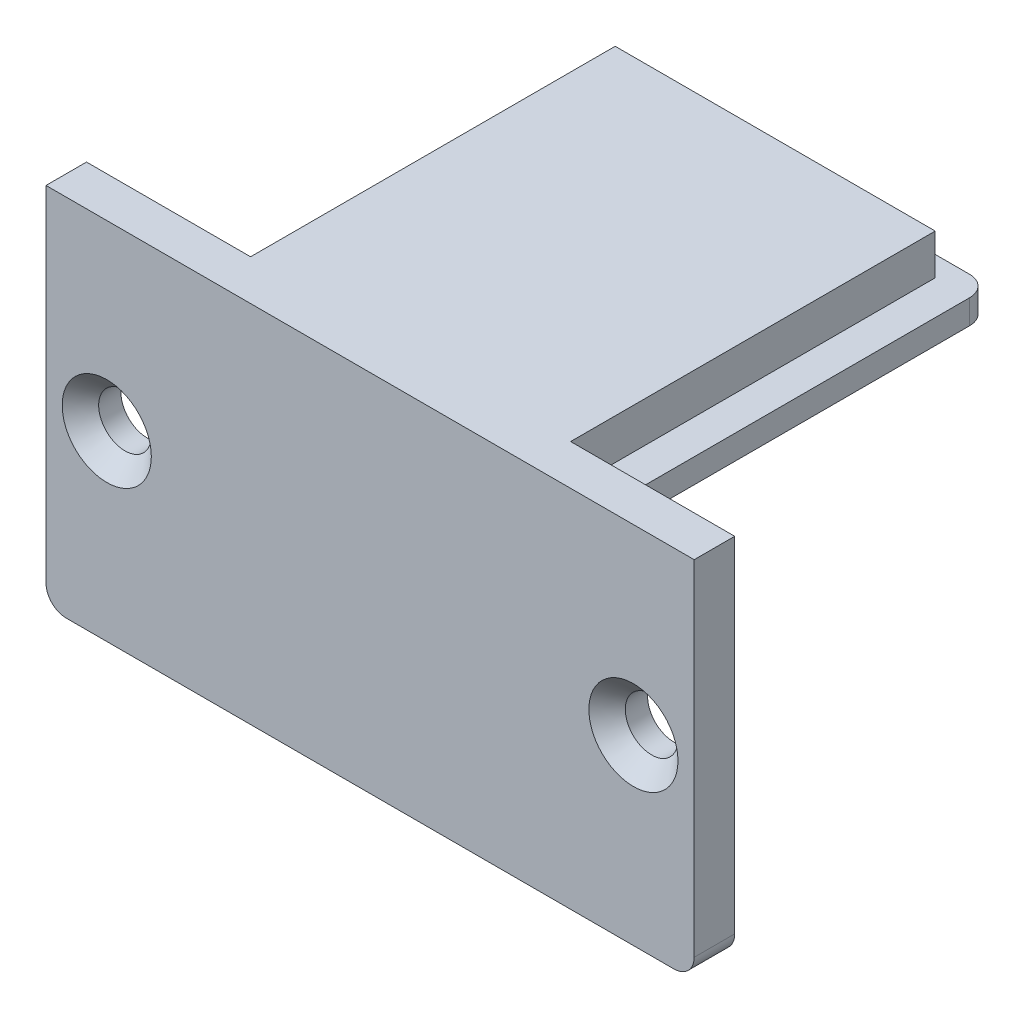
from build123d import *

# Parameters (mm, degrees)
ESQUISSE1_W                                    = 32
ESQUISSE1_H                                    = 18
BOSS_EXTRU_1_DEPTH                             = 2
ESQUISSE2_W                                    = 19
ESQUISSE2_H                                    = 14
BOSS_EXTRU_2_DEPTH                             = 1.4
FRAISAGE_POUR_VIS_T_TE_FRAIS_E_M21_D           = 2.6
FRAISAGE_POUR_VIS_T_TE_FRAIS_E_M21_CSINK_D     = 4.4
FRAISAGE_POUR_VIS_T_TE_FRAIS_E_M21_CSINK_ANGLE = 90
ESQUISSE6_W                                    = 15.8
ESQUISSE6_H                                    = 2
BOSS_EXTRU_3_DEPTH                             = 18
ESQUISSE7_W                                    = 19.2
ESQUISSE7_H                                    = 1.2
BOSS_EXTRU_4_DEPTH                             = 21
CONG_5_R                                       = 1


with BuildPart() as part:
    # Esquisse1 → Boss.-Extru.1 (new body)
    with BuildSketch(Plane.XY):
        Rectangle(ESQUISSE1_W, ESQUISSE1_H)
    extrude(amount=BOSS_EXTRU_1_DEPTH)

    # Esquisse2 → Boss.-Extru.2 (add)
    with BuildSketch(Plane(origin=(0, 0, 0), x_dir=(-1, 0, 0), z_dir=(0, 0, -1))):
        Rectangle(ESQUISSE2_W, ESQUISSE2_H)
    extrude(amount=BOSS_EXTRU_2_DEPTH)

    # Fraisage pour vis à tête fraisée M21 (through all)
    with Locations(Plane.XY.offset(2)):
        with Locations((-13, 0)):
            fraisage_pour_vis_t_te_frais_e_m21 = CounterSinkHole(FRAISAGE_POUR_VIS_T_TE_FRAIS_E_M21_D / 2, FRAISAGE_POUR_VIS_T_TE_FRAIS_E_M21_CSINK_D / 2, counter_sink_angle=FRAISAGE_POUR_VIS_T_TE_FRAIS_E_M21_CSINK_ANGLE)

    # Symétrie1: Fraisage pour vis à tête fraisée M21 across plane
    add(fraisage_pour_vis_t_te_frais_e_m21.mirror(Plane(origin=(0, 0, 0), x_dir=(0, 0, 1), z_dir=(1, 0, 0))), mode=Mode.SUBTRACT)

    # Esquisse6 → Boss.-Extru.3 (add)
    with BuildSketch(Plane(origin=(0, 0, 0), x_dir=(-1, 0, 0), z_dir=(0, 0, -1))):
        with Locations((0, 8)):
            Rectangle(ESQUISSE6_W, ESQUISSE6_H)
    extrude(amount=BOSS_EXTRU_3_DEPTH)

    # Esquisse7 → Boss.-Extru.4 (add)
    with BuildSketch(Plane.XY.offset(2)):
        with Locations((0, 6.4)):
            Rectangle(ESQUISSE7_W, ESQUISSE7_H)
    extrude(amount=-BOSS_EXTRU_4_DEPTH)

    # Congé5
    cong_5_edges = [part.edges().sort_by_distance(p)[0] for p in [
        (9.6, 6.4, -19),
        (-9.6, 6.4, -19),
        (16, -9, 1),
        (-16, -9, 1),
    ]]
    fillet(cong_5_edges, radius=CONG_5_R)


solid = part.part
